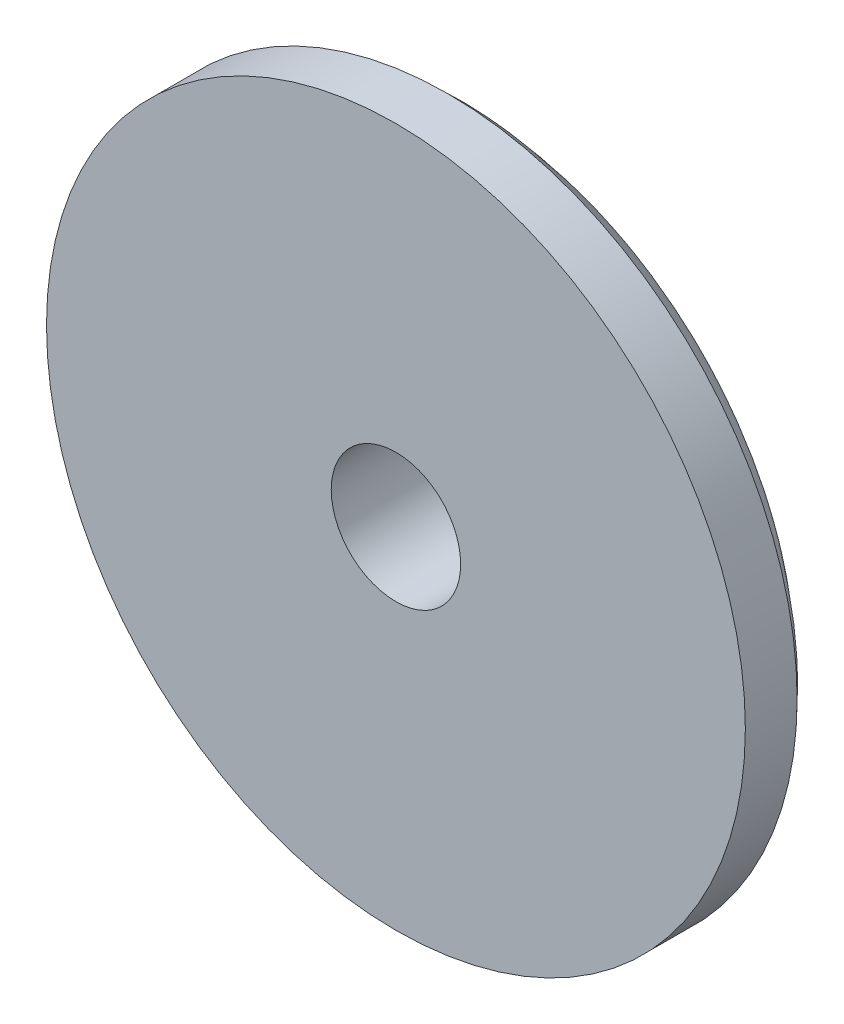
from build123d import *

# Parameters (mm, degrees)
SKETCH_1_R          = 13.5
EXTRUDE_1_DEPTH     = 2
SKETCH_3_R          = 8.5
EXTRUDE_2_DEPTH     = 2.5
SKETCH_7_R          = 2.5
CUT_EXTRUDE_1_DEPTH = 4.5


with BuildPart() as part:
    # 草图1 → 凸台-拉伸1 (new body)
    with BuildSketch(Plane.XY):
        Circle(SKETCH_1_R)
    extrude(amount=EXTRUDE_1_DEPTH)

    # 草图3 → 凸台-拉伸2 (add)
    with BuildSketch(Plane(origin=(0, 0, 0), x_dir=(-1, 0, 0), z_dir=(0, 0, -1))):
        Circle(SKETCH_3_R)
    extrude(amount=EXTRUDE_2_DEPTH)

    # 草图7 → 切除-拉伸1 (cut)
    with BuildSketch(Plane(origin=(0, 0, -2.5), x_dir=(-1, 0, 0), z_dir=(0, 0, -1))):
        Circle(SKETCH_7_R)
    extrude(amount=-CUT_EXTRUDE_1_DEPTH, mode=Mode.SUBTRACT)


with BuildPart() as body_2:
    # 扫描1: sweep along a curve in space
    with BuildLine() as sweep_1_path:
        ThreePointArc((-8.5, 0, -2.5), (-6.01040764, 6.01040764, -2.5), (0, 8.5, -2.5))
        ThreePointArc((0, 8.5, -2.5), (6.01040764, 6.01040764, -2.5), (8.5, 0, -2.5))
        ThreePointArc((8.5, 0, -2.5), (6.01040764, -6.01040764, -2.5), (0, -8.5, -2.5))
        ThreePointArc((0, -8.5, -2.5), (-6.01040764, -6.01040764, -2.5), (-8.5, 0, -2.5))
    # 草图4 → 扫描1 (sweep)
    with BuildSketch(Plane(origin=(0, 0, 0), x_dir=(1, 0, 0), z_dir=(0, 1, 0))):
        with BuildLine():
            Line((-13.5, 0), (-8.5, 2.5))
            ThreePointArc((-8.5, 2.5), (-11.243106023, 1.736212046), (-13.5, 0))
        make_face()
    sweep(path=sweep_1_path.line)


solid = Compound([part.part, body_2.part])
